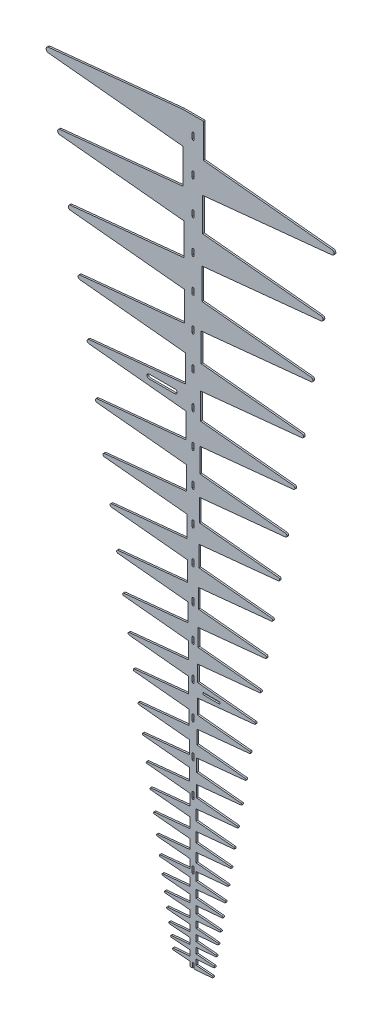
from build123d import *

# Parameters (mm, degrees)
EXTRUDE3_DEPTH      = 0.254
FIN_SLOT_1_DEPTH    = 131.381300107
FIN_SLOT_2_DEPTH    = 131.381300107
LPATTERN1_COUNT     = 18
LPATTERN1_PITCH     = 5.08
SUPPORT_SLOTS_DEPTH = 2.54


with BuildPart() as part:
    # Sketch5 → Extrude3 (new body)
    with BuildSketch(Plane.XY):
        with BuildLine():
            Line((0.819010992, 67.033626358), (11.864537119, 68.140246936))
            ThreePointArc((11.864537119, 68.140246936), (12.047480482, 68.342466528), (11.864473864, 68.544628875))
            Line((11.864473864, 68.544628875), (0.888672301, 69.640795788))
            Line((0.888672301, 69.640795788), (0.888672301, 72.73519832))
            Line((0.888672301, 72.73519832), (12.866181936, 73.928225893))
            ThreePointArc((12.866181936, 73.928225893), (13.072124193, 74.155626114), (12.86632949, 74.383159879))
            Line((12.86632949, 74.383159879), (0.96412688, 75.576484286))
            Line((0.96412688, 75.576484286), (0.96412688, 78.9109324))
            Line((0.96412688, 78.9109324), (13.955245069, 80.210708909))
            ThreePointArc((13.955245069, 80.210708909), (14.18395832, 80.463468174), (13.955203081, 80.716189438))
            Line((13.955203081, 80.716189438), (1.046292918, 82.00557495))
            Line((1.046292918, 82.00557495), (1.046292918, 85.635979461))
            Line((1.046292918, 85.635979461), (15.162196983, 87.055009967))
            ThreePointArc((15.162196983, 87.055009967), (15.390791155, 87.307751731), (15.162166058, 87.560465521))
            Line((15.162166058, 87.560465521), (1.135289398, 88.968812667))
            Line((1.135289398, 88.968812667), (1.135289398, 92.920077999))
            Line((1.135289398, 92.920077999), (16.44837427, 94.456201626))
            ThreePointArc((16.44837427, 94.456201626), (16.69988638, 94.734214233), (16.448358579, 95.012212644))
            Line((16.448358579, 95.012212644), (1.23185718, 96.537780074))
            Line((1.23185718, 96.537780074), (1.23185718, 100.823865241))
            Line((1.23185718, 100.823865241), (17.845965493, 102.489097942))
            ThreePointArc((17.845965493, 102.489097942), (18.120367685, 102.792378372), (17.845965474, 103.095658784))
            Line((17.845965474, 103.095658784), (1.336640287, 104.750388039))
            Line((1.336640287, 104.750388039), (1.336640287, 109.400052488))
            Line((1.336640287, 109.400052488), (19.364448779, 111.207432357))
            ThreePointArc((19.364448779, 111.207432357), (19.661709666, 111.535977432), (19.364464493, 111.864536724))
            Line((19.364464493, 111.864536724), (1.45033752, 113.661384818))
            Line((1.45033752, 113.661384818), (1.45033752, 118.705834642))
            Line((1.45033752, 118.705834642), (21.014107022, 120.669508792))
            ThreePointArc((21.014107022, 120.669508792), (21.334192834, 121.023315248), (21.014138221, 121.377149927))
            Line((21.014138221, 121.377149927), (1.569674337, 123.330580894))
            Line((1.569674337, 123.330580894), (1.569674337, 128.4732))
            Line((1.569674337, 128.4732), (-1.569674337, 128.4732))
            Line((-1.569674337, 128.4732), (-21.879732975, 126.444583973))
            ThreePointArc((-21.879732975, 126.444583973), (-22.222866211, 126.065579731), (-21.879950569, 125.686378602))
            Line((-21.879950569, 125.686378602), (-1.510623136, 123.640033935))
            Line((-1.510623136, 123.640033935), (-1.510623136, 118.408634151))
            Line((-1.510623136, 118.408634151), (-20.160601022, 116.536680003))
            ThreePointArc((-20.160601022, 116.536680003), (-20.480686835, 116.18284562), (-20.160576648, 115.829033289))
            Line((-20.160576648, 115.829033289), (-1.392188384, 113.946499871))
            Line((-1.392188384, 113.946499871), (-1.392188384, 109.126473478))
            Line((-1.392188384, 109.126473478), (-18.577851419, 107.403522992))
            ThreePointArc((-18.577851419, 107.403522992), (-18.875112306, 107.074965912), (-18.577843244, 106.74641623))
            Line((-18.577843244, 106.74641623), (-1.283039155, 105.012958444))
            Line((-1.283039155, 105.012958444), (-1.283039155, 100.571797087))
            Line((-1.283039155, 100.571797087), (-17.121031623, 98.984354506))
            ThreePointArc((-17.121031623, 98.984354506), (-17.395433815, 98.68107822), (-17.12103985, 98.377794491))
            Line((-17.12103985, 98.377794491), (-1.182447536, 96.779832077))
            Line((-1.182447536, 96.779832077), (-1.182447536, 92.687575502))
            Line((-1.182447536, 92.687575502), (-15.780269923, 91.223203035))
            ThreePointArc((-15.780269923, 91.223203035), (-16.031782033, 90.945210625), (-15.780294426, 90.667196049))
            Line((-15.780294426, 90.667196049), (-1.089742676, 89.192213618))
            Line((-1.089742676, 89.192213618), (-1.089742676, 85.421250057))
            Line((-1.089742676, 85.421250057), (-14.546467139, 84.068484946))
            ThreePointArc((-14.546467139, 84.068484946), (-14.775061299, 83.815677785), (-14.546306072, 83.563016359))
            Line((-14.546306072, 83.563016359), (-1.004439598, 82.210409035))
            Line((-1.004439598, 82.210409035), (-1.004439598, 78.713975031))
            Line((-1.004439598, 78.713975031), (-13.411047111, 77.472679496))
            ThreePointArc((-13.411047111, 77.472679496), (-13.616889036, 77.245238871), (-13.411094322, 77.017755526))
            Line((-13.411094322, 77.017755526), (-0.925701883, 75.765960038))
            Line((-0.925701883, 75.765960038), (-0.925701883, 72.554476409))
            Line((-0.925701883, 72.554476409), (-12.343205626, 71.417228584))
            ThreePointArc((-12.343205626, 71.417228584), (-12.549147893, 71.189784277), (-12.343265446, 70.962285819))
            Line((-12.343265446, 70.962285819), (-0.852990369, 69.814737798))
            Line((-0.852990369, 69.814737798), (-0.852990369, 66.866113187))
            Line((-0.852990369, 66.866113187), (-11.382558334, 65.811185024))
            ThreePointArc((-11.382558334, 65.811185024), (-11.565501688, 65.608930992), (-11.382426538, 65.406796252))
            Line((-11.382426538, 65.406796252), (-0.786249198, 64.35217044))
            Line((-0.786249198, 64.35217044), (-0.786249198, 61.613085263))
            Line((-0.786249198, 61.613085263), (-10.498873745, 60.642649927))
            ThreePointArc((-10.498873745, 60.642649927), (-10.658996897, 60.465770106), (-10.498951919, 60.288819548))
            Line((-10.498951919, 60.288819548), (-0.724618208, 59.307856224))
            Line((-0.724618208, 59.307856224), (-0.724618208, 56.793833953))
            Line((-0.724618208, 56.793833953), (-9.663035356, 55.902581645))
            ThreePointArc((-9.663035356, 55.902581645), (-9.823194336, 55.725705867), (-9.663128696, 55.548745617))
            Line((-9.663128696, 55.548745617), (-0.667672427, 54.647012618))
            Line((-0.667672427, 54.647012618), (-0.667672427, 52.340651867))
            Line((-0.667672427, 52.340651867), (-8.916196104, 51.508805019))
            ThreePointArc((-8.916196104, 51.508805019), (-9.05330443, 51.357126617), (-8.916101545, 51.205533745))
            Line((-8.916101545, 51.205533745), (-0.615460973, 50.373659525))
            Line((-0.615460973, 50.373659525), (-0.615460973, 48.238529614))
            Line((-0.615460973, 48.238529614), (-8.206105623, 47.482796867))
            ThreePointArc((-8.206105623, 47.482796867), (-8.343407161, 47.331159544), (-8.206131339, 47.179498941))
            Line((-8.206131339, 47.179498941), (-0.56712671, 46.417643172))
            Line((-0.56712671, 46.417643172), (-0.56712671, 44.451690675))
            Line((-0.56712671, 44.451690675), (-7.575257017, 43.747093224))
            ThreePointArc((-7.575257017, 43.747093224), (-7.689552486, 43.620728725), (-7.575253932, 43.494367016))
            Line((-7.575253932, 43.494367016), (-0.522749283, 42.785482096))
            Line((-0.522749283, 42.785482096), (-0.522749283, 40.971670308))
            Line((-0.522749283, 40.971670308), (-6.972214974, 40.327554815))
            ThreePointArc((-6.972214974, 40.327554815), (-7.086594117, 40.201141231), (-6.972130889, 40.074803777))
            Line((-6.972130889, 40.074803777), (-0.481764082, 39.430964612))
            Line((-0.481764082, 39.430964612), (-0.481764082, 37.760639251))
            Line((-0.481764082, 37.760639251), (-6.416352333, 37.176092565))
            ThreePointArc((-6.416352333, 37.176092565), (-6.530903288, 37.049658202), (-6.416260796, 36.923306831))
            Line((-6.416260796, 36.923306831), (-0.443991806, 36.339415562))
            Line((-0.443991806, 36.339415562), (-0.443991806, 34.801332065))
            Line((-0.443991806, 34.801332065), (-5.904036555, 34.271684528))
            ThreePointArc((-5.904036555, 34.271684528), (-6.018774562, 34.145227797), (-5.903936877, 34.018861578))
            Line((-5.903936877, 34.018861578), (-0.4572, 33.494839896))
            Line((-0.4572, 33.494839896), (-0.4572, 32.069435672))
            Line((-0.4572, 32.069435672), (-5.431851278, 31.59496362))
            ThreePointArc((-5.431851278, 31.59496362), (-5.546792989, 31.468482832), (-5.431742702, 31.342100801))
            Line((-5.431742702, 31.342100801), (-0.4572, 30.871949659))
            Line((-0.4572, 30.871949659), (-0.4572, 29.553005827))
            Line((-0.4572, 29.553005827), (-4.996647706, 29.128081))
            ThreePointArc((-4.996647706, 29.128081), (-5.111811326, 29.001574365), (-4.996529395, 28.875175533))
            Line((-4.996529395, 28.875175533), (-0.4572, 28.454545672))
            Line((-0.4572, 28.454545672), (-0.4572, 27.233982104))
            Line((-0.4572, 27.233982104), (-4.595523603, 26.854587046))
            ThreePointArc((-4.595523603, 26.854587046), (-4.710929048, 26.728052668), (-4.595394638, 26.601636034))
            Line((-4.595394638, 26.601636034), (-0.4572, 26.226507514))
            Line((-0.4572, 26.226507514), (-0.4572, 25.096901802))
            Line((-0.4572, 25.096901802), (-4.22580394, 24.759321665))
            ThreePointArc((-4.22580394, 24.759321665), (-4.341473014, 24.632757549), (-4.225663305, 24.506322106))
            Line((-4.225663305, 24.506322106), (-0.4572, 24.172977331))
            Line((-0.4572, 24.172977331), (-0.4572, 23.127515622))
            Line((-0.4572, 23.127515622), (-3.885023044, 22.828313199))
            ThreePointArc((-3.885023044, 22.828313199), (-4.000979634, 22.701717251), (-3.884869615, 22.575262009))
            Line((-3.884869615, 22.575262009), (-0.4572, 22.280260723))
            Line((-0.4572, 22.280260723), (-0.4572, 21.31269268))
            Line((-0.4572, 21.31269268), (-3.570908149, 21.048685259))
            ThreePointArc((-3.570908149, 21.048685259), (-3.687178449, 20.922055292), (-3.57074068, 20.795579297))
            Line((-3.57074068, 20.795579297), (-0.4572, 20.535735398))
            Line((-0.4572, 20.535735398), (-0.4572, 19.640332994))
            Line((-0.4572, 19.640332994), (-3.281364225, 19.408570851))
            ThreePointArc((-3.281364225, 19.408570851), (-3.397976984, 19.281904598), (-3.281181337, 19.155406961))
            Line((-3.281181337, 19.155406961), (-0.4572, 18.927766956))
            Line((-0.4572, 18.927766956), (-0.4572, 18.099286848))
            Line((-0.4572, 18.099286848), (-3.014459998, 17.897033248))
            ThreePointArc((-3.014459998, 17.897033248), (-3.131446802, 17.770328375), (-3.014260157, 17.643808307))
            Line((-3.014260157, 17.643808307), (-0.4572, 17.445631252))
            Line((-0.4572, 17.445631252), (-0.4572, 16.871594553))
            ThreePointArc((-0.4572, 16.871594553), (-0.420002561, 16.781791992), (-0.3302, 16.744594553))
            Line((-0.3302, 16.744594553), (-0.127, 16.744594553))
            Line((-0.127, 16.744594553), (-0.127, 17.39646))
            ThreePointArc((-0.127, 17.39646), (0, 17.52346), (0.127, 17.39646))
            Line((0.127, 17.39646), (0.127, 16.744594553))
            Line((0.127, 16.744594553), (0.4572, 16.744594553))
            Line((0.4572, 16.744594553), (2.88893583, 16.933058734))
            ThreePointArc((2.88893583, 16.933058734), (3.006122515, 17.059679028), (2.88893583, 17.186299322))
            Line((2.88893583, 17.186299322), (0.4572, 17.374763502))
            Line((0.4572, 17.374763502), (0.4572, 18.17160671))
            Line((0.4572, 18.17160671), (3.145005655, 18.384185161))
            ThreePointArc((3.145005655, 18.384185161), (3.261992461, 18.510693922), (3.145196817, 18.637379191))
            Line((3.145196817, 18.637379191), (0.4572, 18.854057538))
            Line((0.4572, 18.854057538), (0.4572, 19.715372293))
            Line((0.4572, 19.715372293), (3.423014205, 19.958758796))
            ThreePointArc((3.423014205, 19.958758796), (3.539626968, 20.085245506), (3.423189202, 20.211893328))
            Line((3.423189202, 20.211893328), (0.4572, 20.459423159))
            Line((0.4572, 20.459423159), (0.4572, 21.390223513))
            Line((0.4572, 21.390223513), (3.724606997, 21.667262868))
            ThreePointArc((3.724606997, 21.667262868), (3.8408773, 21.79372837), (3.724767282, 21.920341049))
            Line((3.724767282, 21.920341049), (0.4572, 22.20156318))
            Line((0.4572, 22.20156318), (0.4572, 23.20733033))
            Line((0.4572, 23.20733033), (4.051795647, 23.521089737))
            ThreePointArc((4.051795647, 23.521089737), (4.167752239, 23.647534958), (4.051942532, 23.774114722))
            Line((4.051942532, 23.774114722), (0.4572, 24.09209278))
            Line((0.4572, 24.09209278), (0.4572, 25.178810987))
            Line((0.4572, 25.178810987), (4.406762362, 25.532600833))
            ThreePointArc((4.406762362, 25.532600833), (4.522431437, 25.659026747), (4.406897029, 25.785575737))
            Line((4.406897029, 25.785575737), (0.4572, 26.143616895))
            Line((0.4572, 26.143616895), (0.4572, 27.317812871))
            Line((0.4572, 27.317812871), (4.791874502, 27.715209073))
            ThreePointArc((4.791874502, 27.715209073), (4.907279948, 27.841616681), (4.791998019, 27.968136944))
            Line((4.791998019, 27.968136944), (0.4572, 28.369814225))
            Line((0.4572, 28.369814225), (0.4572, 29.638600219))
            Line((0.4572, 29.638600219), (5.209700379, 30.083468303))
            ThreePointArc((5.209700379, 30.083468303), (5.324864, 30.209858609), (5.209813713, 30.33635209))
            Line((5.209813713, 30.33635209), (0.4572, 30.785528407))
            Line((0.4572, 30.785528407), (0.4572, 32.156649271))
            Line((0.4572, 32.156649271), (5.663026393, 32.653170332))
            ThreePointArc((5.663026393, 32.653170332), (5.777968105, 32.779544335), (5.663130421, 32.906012877))
            Line((5.663130421, 32.906012877), (0.4572, 33.406866962))
            Line((0.4572, 33.406866962), (0.4572, 34.888751499))
            Line((0.4572, 34.888751499), (6.154875621, 35.44145024))
            ThreePointArc((6.154875621, 35.44145024), (6.269613629, 35.567808916), (6.154971138, 35.694254259))
            Line((6.154971138, 35.694254259), (0.462492552, 36.250791238))
            Line((0.462492552, 36.250791238), (0.462492552, 37.853646898))
            Line((0.462492552, 37.853646898), (6.688527982, 38.466900627))
            ThreePointArc((6.688527982, 38.466900627), (6.803078938, 38.593244925), (6.688615711, 38.719668706))
            Line((6.688615711, 38.719668706), (0.501838509, 39.333392026))
            Line((0.501838509, 39.333392026), (0.501838509, 41.073997059))
            Line((0.501838509, 41.073997059), (7.267542115, 41.749695593))
            ThreePointArc((7.267542115, 41.749695593), (7.381921259, 41.876026428), (7.267622712, 42.002430187))
            Line((7.267622712, 42.002430187), (0.54447235, 42.678209948))
            Line((0.54447235, 42.678209948), (0.54447235, 44.563450849))
            Line((0.54447235, 44.563450849), (7.886404564, 45.301608745))
            ThreePointArc((7.886404564, 45.301608745), (8.009843659, 45.43813557), (7.88629543, 45.574563643))
            Line((7.88629543, 45.574563643), (0.590841523, 46.302156297))
            Line((0.590841523, 46.302156297), (0.590841523, 48.358630388))
            Line((0.590841523, 48.358630388), (8.553811114, 49.151432207))
            ThreePointArc((8.553811114, 49.151432207), (8.691112644, 49.303032882), (8.55390976, 49.454722841))
            Line((8.55390976, 49.454722841), (0.641106127, 50.247728789))
            Line((0.641106127, 50.247728789), (0.641106127, 52.472639524))
            Line((0.641106127, 52.472639524), (9.293477719, 53.345213614))
            ThreePointArc((9.293477719, 53.345213614), (9.430586045, 53.496890123), (9.293386927, 53.648484511))
            Line((9.293386927, 53.648484511), (0.695632326, 54.510350636))
            Line((0.695632326, 54.510350636), (0.695632326, 56.935447569))
            Line((0.695632326, 56.935447569), (10.072408866, 57.870408826))
            ThreePointArc((10.072408866, 57.870408826), (10.232567842, 58.04727422), (10.072522869, 58.224242781))
            Line((10.072522869, 58.224242781), (0.754664366, 59.159393731))
            Line((0.754664366, 59.159393731), (0.754664366, 61.767045397))
            Line((0.754664366, 61.767045397), (10.91980234, 62.78269354))
            ThreePointArc((10.91980234, 62.78269354), (11.102800229, 62.984925628), (10.919725071, 63.187087768))
            Line((10.919725071, 63.187087768), (0.819010992, 64.192400669))
            Line((0.819010992, 64.192400669), (0.819010992, 67.033626358))
        make_face()
    extrude(amount=EXTRUDE3_DEPTH)

    # Sketch6 → Fin Slot 1 (cut, through all)
    with BuildSketch(Plane.XY):
        with BuildLine():
            Line((-0.1397, 29.2227), (-0.1397, 30.0101))
            ThreePointArc((-0.1397, 30.0101), (0, 30.1498), (0.1397, 30.0101))
            Line((0.1397, 30.0101), (0.1397, 29.2227))
            ThreePointArc((0.1397, 29.2227), (0, 29.083), (-0.1397, 29.2227))
        make_face()
    extrude(amount=FIN_SLOT_1_DEPTH, mode=Mode.SUBTRACT)

    # Sketch7 → Fin Slot 2 (cut, through all)
    with BuildSketch(Plane.XY):
        with BuildLine():
            Line((-0.1397, 39.7637), (-0.1397, 38.9763))
            ThreePointArc((-0.1397, 38.9763), (0, 38.8366), (0.1397, 38.9763))
            Line((0.1397, 38.9763), (0.1397, 39.7637))
            ThreePointArc((0.1397, 39.7637), (0, 39.9034), (-0.1397, 39.7637))
        make_face()
    fin_slot_2 = extrude(amount=FIN_SLOT_2_DEPTH, mode=Mode.SUBTRACT)

    # LPattern1: Fin Slot 2 ×18
    with Locations(*[(0, i * LPATTERN1_PITCH, 0) for i in range(1, LPATTERN1_COUNT)]):
        add(fin_slot_2, mode=Mode.SUBTRACT)

    # Sketch9 → Support Slots (cut)
    with BuildSketch(Plane.XY):
        with BuildLine():
            Line((1.6129, 53.34), (3.9243, 53.34))
            ThreePointArc((3.9243, 53.34), (4.0767, 53.4924), (3.9243, 53.6448))
            Line((3.9243, 53.6448), (1.6129, 53.6448))
            ThreePointArc((1.6129, 53.6448), (1.4605, 53.4924), (1.6129, 53.34))
        make_face()
        with BuildLine():
            Line((-6.6548, 90.6145), (-2.7432, 90.6145))
            ThreePointArc((-2.7432, 90.6145), (-2.4257, 90.932), (-2.7432, 91.2495))
            Line((-2.7432, 91.2495), (-6.6548, 91.2495))
            ThreePointArc((-6.6548, 91.2495), (-6.9723, 90.932), (-6.6548, 90.6145))
        make_face()
    extrude(amount=SUPPORT_SLOTS_DEPTH, mode=Mode.SUBTRACT)


solid = part.part
